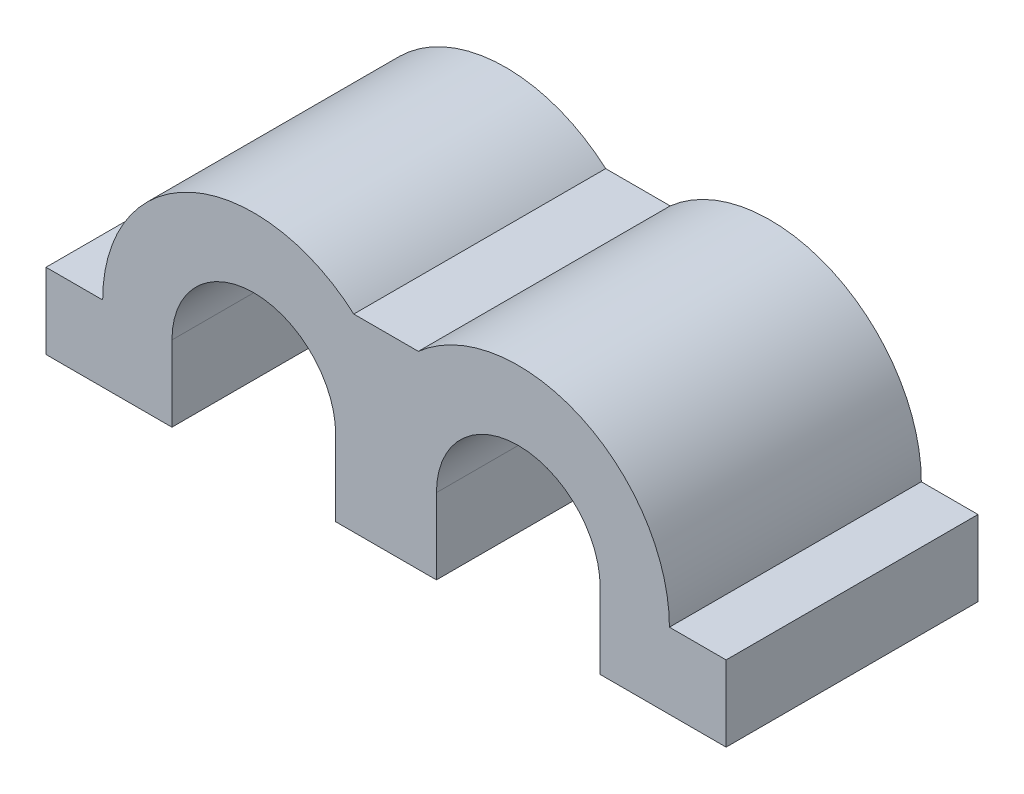
from build123d import *

# Parameters (mm, degrees)
SKETCH1_W           = 5
SKETCH1_H           = 3
BOSS_EXTRUDE1_DEPTH = 10


with BuildPart() as part:
    # Sketch1 → Boss-Extrude1 (new body)
    with BuildSketch(Plane.XY):
        with BuildLine():
            ThreePointArc((2, 0), (5.25, 3.25), (8.5, 0))
            Line((8.5, 0), (11.25, 0))
            ThreePointArc((11.25, 0), (7.718626967, 5.468626967), (1.281373033, 4.5))
            Line((1.281373033, 4.5), (-1.281373033, 4.5))
            ThreePointArc((-1.281373033, 4.5), (-7.718626967, 5.468626967), (-11.25, 0))
            Line((-11.25, 0), (-13.5, 0))
            Line((-13.5, 0), (-13.5, -3))
            Line((-13.5, -3), (-8.5, -3))
            Line((-8.5, -3), (-8.5, 0))
            ThreePointArc((-8.5, 0), (-5.25, 3.25), (-2, 0))
            Line((-2, 0), (-2, -3))
            Line((-2, -3), (2, -3))
            Line((2, -3), (2, 0))
        make_face()
        with Locations((11, -1.5)):
            Rectangle(SKETCH1_W, SKETCH1_H)
    extrude(amount=BOSS_EXTRUDE1_DEPTH)


solid = part.part
